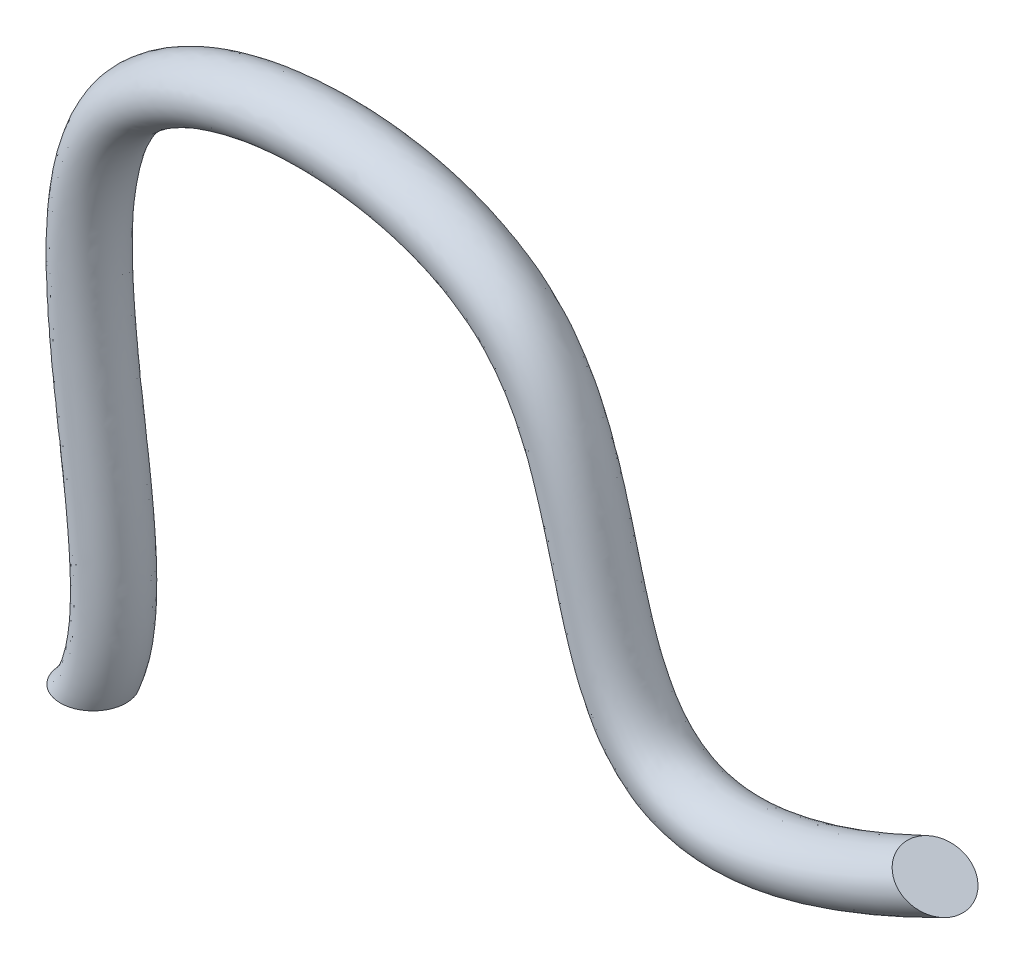
from build123d import *

# Parameters (mm, degrees)
SKETCH6_R = 3.81


with BuildPart() as part:
    # Sweep2: sweep along a path in Sketch3
    with BuildLine() as sweep2_path:  # in the path sketch's own coordinates; laid on its plane below (add() does not lay a ready-made edge on the line's plane)
        add(Edge.make_bspline(
            [(0, 0), (7.992705823, 13.152085189), (-19.802762771, 70.726771303), (75.193983345, 72.205849218), (50.418836023, 6.309324932), (97.689172301, 29.50616608)],
            knots=[0, 0, 0, 0, 0.355439333, 0.614638244, 1, 1, 1, 1], degree=3))
    # Sketch6 → Sweep2 (sweep)
    with BuildSketch(Plane(origin=(0, 0, 0), x_dir=(1, 0, 0), z_dir=(0, 1, 0))):
        Circle(SKETCH6_R)
    sweep(path=Plane.XY * sweep2_path.line)


solid = part.part
